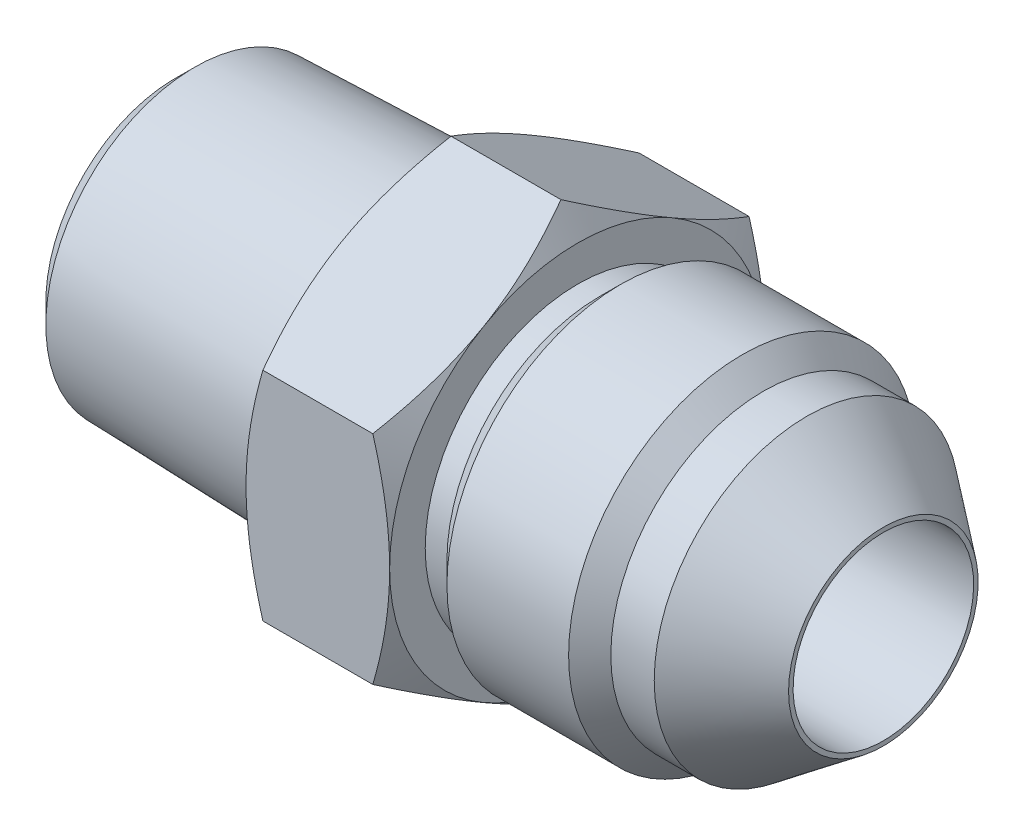
from build123d import *

# Parameters (mm, degrees)
SKETCH6_W           = 38.862
SKETCH6_H           = 9.525
EXTRUDE1_DEPTH      = 7.874
SKETCH7_W           = 38.862
SKETCH7_H           = 4.953
SKETCH17_R          = 9.525
CUT_EXTRUDE1_DEPTH  = 14.224
SKETCH19_R          = 8.5725
BOSS_EXTRUDE1_DEPTH = 14.224
BOSS_EXTRUDE1_DRAFT = -1.75
CHAMFER1_SIZE       = 1.058333333
CHAMFER1_SIZE2      = 1.092196811
SKETCH22_R          = 8.5725
BOSS_EXTRUDE3_DEPTH = 14.224
BOSS_EXTRUDE3_DRAFT = -15
SKETCH23_R          = 4.953
CUT_EXTRUDE2_DEPTH  = 14.224


with BuildPart() as part:
    # Sketch6 → Revolve3 (revolve)
    with BuildSketch(Plane.XY, mode=Mode.PRIVATE) as revolve3_sk:
        with Locations((0, 4.7625)):
            Rectangle(SKETCH6_W, SKETCH6_H)
    revolve(revolve3_sk.sketch.rotate(Axis((-19.431, 0, 0), (1, 0, 0)), 90), axis=Axis((-19.431, 0, 0), (1, 0, 0)))

    # Sketch12 → Extrude1 (add)
    with BuildSketch(Plane(origin=(-5.207, 0, 0), x_dir=(0, 0, -1), z_dir=(1, 0, 0))):
        Polygon((0, 11.91506618), (-10.31875, 5.95753309), (-10.31875, -5.95753309), (0, -11.91506618), (10.31875, -5.95753309), (10.31875, 5.95753309), align=None)
    extrude(amount=EXTRUDE1_DEPTH)

    # Sketch10 → Cut-Revolve6 (revolve, cut)
    with BuildSketch(Plane.XY, mode=Mode.PRIVATE) as cut_revolve6_sk:
        Polygon((5.015736496, 9.525), (2.667, 9.525), (2.667, 8.366888504), (3.857625, 8.366888504), align=None)
        Polygon((19.431, 9.525), (11.689898093, 9.525), (12.84800959, 8.366888504), (15.22925959, 8.366888504), (19.431, 5.20065), align=None)
    revolve(cut_revolve6_sk.sketch.rotate(Axis((-19.431, 0, 0), (1, 0, 0)), 90), axis=Axis((-19.431, 0, 0), (1, 0, 0)), mode=Mode.SUBTRACT)

    # Sketch7 → Cut-Revolve5 (revolve, cut)
    with BuildSketch(Plane.XY):
        with Locations((0, 2.4765)):
            Rectangle(SKETCH7_W, SKETCH7_H)
    revolve(axis=Axis((19.431, 0, 0), (-1, 0, 0)), mode=Mode.SUBTRACT)

    # Sketch13 → Cut-Revolve7 (revolve, cut)
    with BuildSketch(Plane.XY):
        Polygon((-5.207, 11.91506618), (-5.207, 10.31875), (-4.285366424, 11.91506618), align=None)
        Polygon((1.745366424, 11.91506618), (2.667, 10.31875), (2.667, 11.91506618), align=None)
    revolve(axis=Axis((-19.431, 0, 0), (1, 0, 0)), mode=Mode.SUBTRACT)

    # Sketch17 → Cut-Extrude1 (cut)
    with BuildSketch(Plane.ZY.offset(19.431)):
        Circle(SKETCH17_R)
    extrude(amount=-CUT_EXTRUDE1_DEPTH, mode=Mode.SUBTRACT)


with BuildPart() as body_2:
    # Sketch19 → Boss-Extrude1 (with draft: the straight prism first)
    with BuildSketch(Plane(origin=(-5.207, 0, 0), x_dir=(0, 0, -1), z_dir=(1, 0, 0))):
        Circle(SKETCH19_R)
    extrude(amount=-BOSS_EXTRUDE1_DEPTH)
    # Boss-Extrude1: the draft: its side faces are tilted about the plane it starts from
    boss_extrude1_sides = [body_2.faces().sort_by_distance(p)[0] for p in [
        (-12.319, 0, 8.5725),
    ]]
    draft(boss_extrude1_sides, Plane(origin=(-5.207, 0, 0), x_dir=(0, 0, -1), z_dir=(1, 0, 0)), BOSS_EXTRUDE1_DRAFT)

    # Chamfer1
    chamfer1_edges = [body_2.edges().sort_by_distance(p)[0] for p in [
        (-19.431, 0, 8.137917495),
    ]]
    chamfer1_side = [body_2.faces().sort_by_distance(p)[0] for p in [
        (-19.431, 0, 0),
    ]]
    chamfer(chamfer1_edges, length=CHAMFER1_SIZE, length2=CHAMFER1_SIZE2, reference=chamfer1_side[0])


with BuildPart() as boss_extrude3_tool:
    # Sketch22 → Boss-Extrude3 (with draft: the straight prism first)
    with BuildSketch(Plane(origin=(-5.207, 0, 0), x_dir=(0, 0, -1), z_dir=(1, 0, 0))):
        Circle(SKETCH22_R)
    extrude(amount=-BOSS_EXTRUDE3_DEPTH)
    # Boss-Extrude3: the draft: its side faces are tilted about the plane it starts from
    boss_extrude3_sides = [boss_extrude3_tool.faces().sort_by_distance(p)[0] for p in [
        (-12.319, 0, 8.5725),
    ]]
    draft(boss_extrude3_sides, Plane(origin=(-5.207, 0, 0), x_dir=(0, 0, -1), z_dir=(1, 0, 0)), BOSS_EXTRUDE3_DRAFT)


with BuildPart() as body_2_1:
    add(body_2.part)

    # Boss-Extrude3: add boss_extrude3_tool
    add(boss_extrude3_tool.part)

    # Combine1: union part
    add(part.part)

    # Sketch23 → Cut-Extrude2 (cut)
    with BuildSketch(Plane.ZY.offset(19.431)):
        with Locations(Location((0, 0, 0), (0, 0, 90))):
            Circle(SKETCH23_R)
    extrude(amount=-CUT_EXTRUDE2_DEPTH, mode=Mode.SUBTRACT)


solid = body_2_1.part
